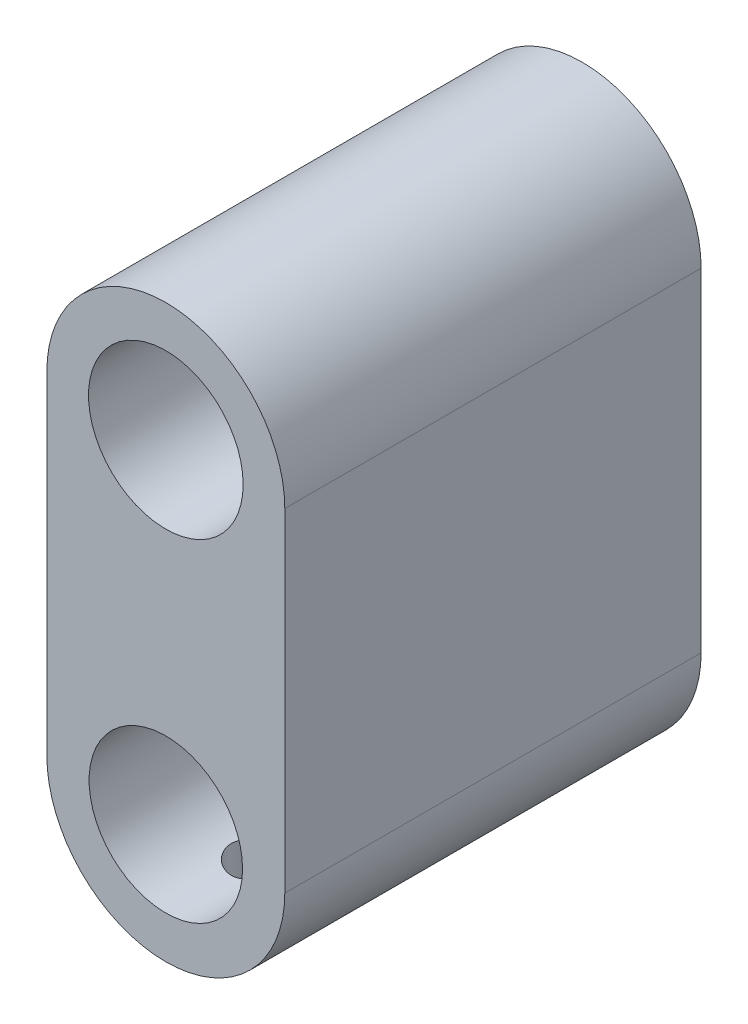
from build123d import *

# Parameters (mm, degrees)
CROQUIS1_R              = 6.45
CROQUIS1_R_2            = 6.5
SALIENTE_EXTRUIR1_DEPTH = 35
CROQUIS2_R              = 2
CORTAR_EXTRUIR1_DEPTH   = 10


with BuildPart() as part:
    # Croquis1 → Saliente-Extruir1 (new body)
    with BuildSketch(Plane.XY):
        with BuildLine():
            Line((10, 28), (10, 0))
            ThreePointArc((10, 0), (0, -10), (-10, 0))
            Line((-10, 0), (-10, 28))
            ThreePointArc((-10, 28), (0, 38), (10, 28))
        make_face()
        Circle(CROQUIS1_R, mode=Mode.SUBTRACT)
        with Locations((0, 28)):
            Circle(CROQUIS1_R_2, mode=Mode.SUBTRACT)
    extrude(amount=SALIENTE_EXTRUIR1_DEPTH)

    # Croquis2 → Cortar-Extruir1 (cut)
    with BuildSketch(Plane(origin=(0, 0, 0), x_dir=(1, 0, 0), z_dir=(0, 1, 0))):
        with Locations(Location((0, -7.5, 0), (0, 0, 270))):
            Circle(CROQUIS2_R)
        with Locations(Location((0, -27.5, 0), (0, 0, 270))):
            Circle(CROQUIS2_R)
    extrude(amount=-CORTAR_EXTRUIR1_DEPTH, mode=Mode.SUBTRACT)


solid = part.part
